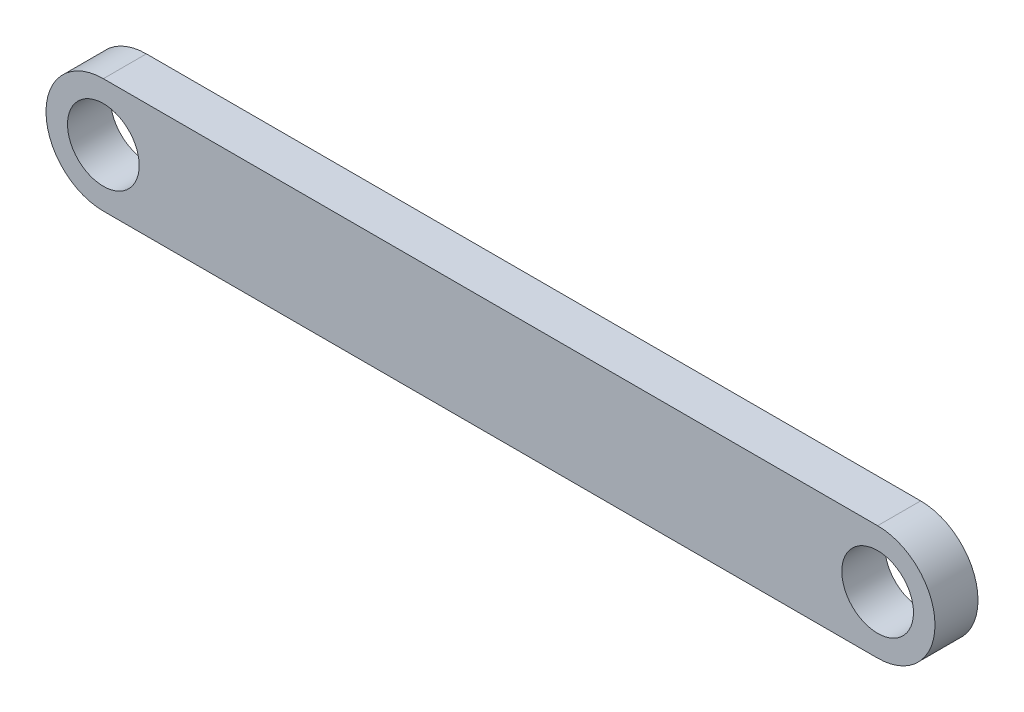
from build123d import *

# Parameters (mm, degrees)
SKETCH2_R           = 2.5
BOSS_EXTRUDE1_DEPTH = 3


with BuildPart() as part:
    # Sketch2 → Boss-Extrude1 (new body)
    with BuildSketch(Plane.XY):
        with BuildLine():
            Line((-54, 4), (0, 4))
            ThreePointArc((0, 4), (4, 0), (0, -4))
            Line((0, -4), (-54, -4))
            ThreePointArc((-54, -4), (-58, 0), (-54, 4))
        make_face()
        with Locations((-54, 0)):
            Circle(SKETCH2_R, mode=Mode.SUBTRACT)
        Circle(SKETCH2_R, mode=Mode.SUBTRACT)
    extrude(amount=BOSS_EXTRUDE1_DEPTH)


solid = part.part
